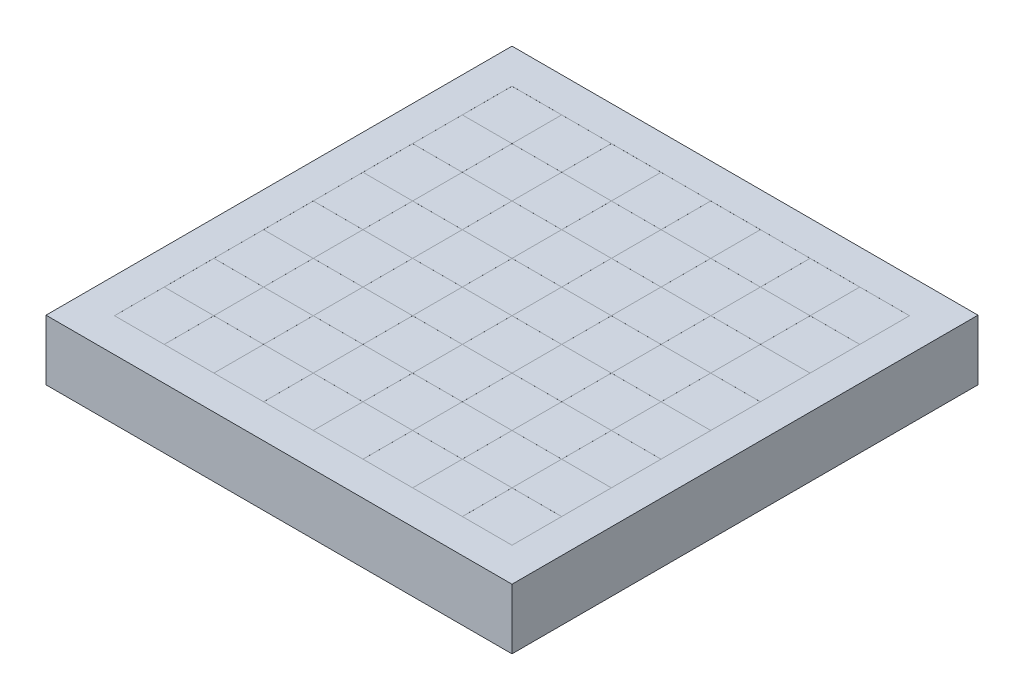
from build123d import *

# Parameters (mm, degrees)
SKETCH1_W           = 255
SKETCH1_H           = 255
BOSS_EXTRUDE1_DEPTH = 33
SKETCH2_W           = 255
SKETCH2_H           = 255
SKETCH2_W_2         = 27.1859502
SKETCH2_H_2         = 27.1859502
SKETCH2_W_3         = 27.19
SKETCH2_H_3         = 27.19
BOSS_EXTRUDE3_DEPTH = 0.02
SKETCH3_W           = 217.52
SKETCH3_H           = 217.52
CUT_EXTRUDE4_DEPTH  = 0.01


with BuildPart() as part:
    # Sketch1 → Boss-Extrude1 (new body)
    with BuildSketch(Plane(origin=(0, 0, 0), x_dir=(1, 0, 0), z_dir=(0, 1, 0))):
        Rectangle(SKETCH1_W, SKETCH1_H)
    extrude(amount=BOSS_EXTRUDE1_DEPTH)

    # Sketch2 → Boss-Extrude3 (add)
    with BuildSketch(Plane(origin=(0, 33, 0), x_dir=(1, 0, 0), z_dir=(0, 1, 0))):
        Rectangle(SKETCH2_W, SKETCH2_H)
        with Locations((-94.9070249, -68.2208257)):
            Rectangle(SKETCH2_W_2, SKETCH2_H_2, mode=Mode.SUBTRACT)
        with Locations((-94.9070249, -13.8448755)):
            Rectangle(SKETCH2_W_2, SKETCH2_H_2, mode=Mode.SUBTRACT)
        with Locations((-94.9070249, 40.5310747)):
            Rectangle(SKETCH2_W_2, SKETCH2_H_2, mode=Mode.SUBTRACT)
        with Locations((-94.9070249, 94.9070249)):
            Rectangle(SKETCH2_W_2, SKETCH2_H_2, mode=Mode.SUBTRACT)
        with Locations((-67.715, -95.425)):
            Rectangle(SKETCH2_W_3, SKETCH2_H_3, mode=Mode.SUBTRACT)
        with Locations((-13.335, -95.425)):
            Rectangle(SKETCH2_W_3, SKETCH2_H_3, mode=Mode.SUBTRACT)
        Polygon((-54.12, -27.45), (-54.12, -54.6278506), (-26.9380996, -54.6278506), (-26.9380996, -81.8138008), (-54.1240498, -81.8138008), (-54.1240498, -54.64), (-81.31, -54.64), (-81.31, -27.45), align=None, mode=Mode.SUBTRACT)
        Polygon((-54.12, 26.93), (-54.12, -0.2519004), (-26.9380996, -0.2519004), (-26.9380996, -27.4378506), (-54.1240498, -27.4378506), (-54.1240498, -0.26), (-81.31, -0.26), (-81.31, 26.93), align=None, mode=Mode.SUBTRACT)
        with Locations((41.045, -95.425)):
            Rectangle(SKETCH2_W_3, SKETCH2_H_3, mode=Mode.SUBTRACT)
        with Locations((95.425, -95.425)):
            Rectangle(SKETCH2_W_3, SKETCH2_H_3, mode=Mode.SUBTRACT)
        Polygon((0.26, -27.45), (0.26, -54.6278506), (27.4378506, -54.6278506), (27.4378506, -81.8138008), (0.2519004, -81.8138008), (0.2519004, -54.64), (-26.93, -54.64), (-26.93, -27.45), align=None, mode=Mode.SUBTRACT)
        Polygon((54.64, -27.45), (54.64, -54.6278506), (81.8138008, -54.6278506), (81.8138008, -81.8138008), (54.6278506, -81.8138008), (54.6278506, -54.64), (27.45, -54.64), (27.45, -27.45), align=None, mode=Mode.SUBTRACT)
        Polygon((0.26, 26.93), (0.26, -0.2519004), (27.4378506, -0.2519004), (27.4378506, -27.4378506), (0.2519004, -27.4378506), (0.2519004, -0.26), (-26.93, -0.26), (-26.93, 26.93), align=None, mode=Mode.SUBTRACT)
        Polygon((54.64, 26.93), (54.64, -0.2519004), (81.8138008, -0.2519004), (81.8138008, -27.4378506), (54.6278506, -27.4378506), (54.6278506, -0.26), (27.45, -0.26), (27.45, 26.93), align=None, mode=Mode.SUBTRACT)
        with Locations((95.425, -41.045)):
            Rectangle(SKETCH2_W_3, SKETCH2_H_3, mode=Mode.SUBTRACT)
        Polygon((-54.12, 81.31), (-54.12, 54.1240498), (-26.9380996, 54.1240498), (-26.9380996, 26.9380996), (-54.1240498, 26.9380996), (-54.1240498, 54.12), (-81.31, 54.12), (-81.31, 81.31), align=None, mode=Mode.SUBTRACT)
        with Locations((-40.5310747, 94.9070249)):
            Rectangle(SKETCH2_W_2, SKETCH2_H_2, mode=Mode.SUBTRACT)
        Polygon((0.26, 81.31), (0.26, 54.1240498), (27.4378506, 54.1240498), (27.4378506, 26.9380996), (0.2519004, 26.9380996), (0.2519004, 54.12), (-26.93, 54.12), (-26.93, 81.31), align=None, mode=Mode.SUBTRACT)
        Polygon((54.64, 81.31), (54.64, 54.1240498), (81.8138008, 54.1240498), (81.8138008, 26.9380996), (54.6278506, 26.9380996), (54.6278506, 54.12), (27.45, 54.12), (27.45, 81.31), align=None, mode=Mode.SUBTRACT)
        with Locations((95.425, 13.335)):
            Rectangle(SKETCH2_W_3, SKETCH2_H_3, mode=Mode.SUBTRACT)
        with Locations((13.8448755, 94.9070249)):
            Rectangle(SKETCH2_W_2, SKETCH2_H_2, mode=Mode.SUBTRACT)
        with Locations((95.425, 67.715)):
            Rectangle(SKETCH2_W_3, SKETCH2_H_3, mode=Mode.SUBTRACT)
        with Locations((68.2208257, 94.9070249)):
            Rectangle(SKETCH2_W_2, SKETCH2_H_2, mode=Mode.SUBTRACT)
    extrude(amount=BOSS_EXTRUDE3_DEPTH)

    # Sketch3 → Cut-Extrude4 (cut)
    with BuildSketch(Plane(origin=(0, 33.02, 0), x_dir=(1, 0, 0), z_dir=(0, 1, 0))):
        with Locations((0.26, -0.26)):
            Rectangle(SKETCH3_W, SKETCH3_H)
    extrude(amount=-CUT_EXTRUDE4_DEPTH, mode=Mode.SUBTRACT)


solid = part.part
